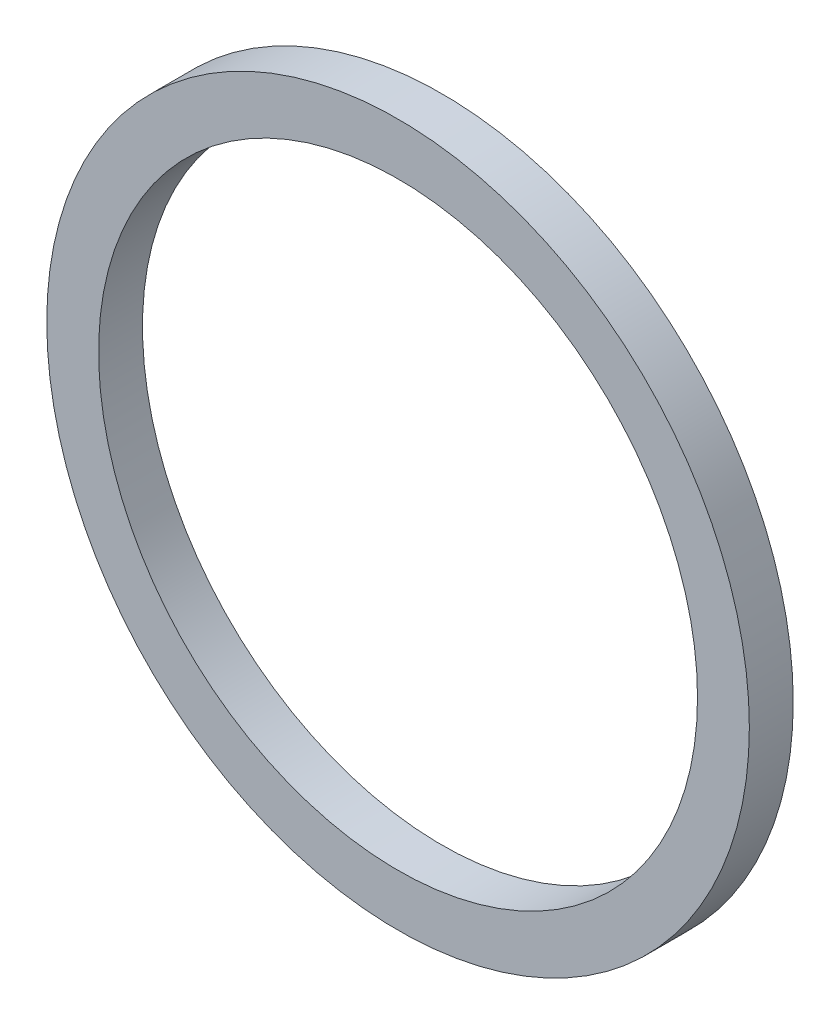
from build123d import *

# Parameters (mm, degrees)
BOSS_EXTRUDE1_DEPTH      = 19.05
BOSS_EXTRUDE1_DEPTH_BACK = 19.05
SKETCH1_R                = 305
SKETCH1_R_2              = 260


with BuildPart() as part:
    # Sketch1 → Boss-Extrude1 (new, two sides: drawn at the far end of the back side and taken through both)
    with BuildSketch(Plane.XY.offset(-BOSS_EXTRUDE1_DEPTH_BACK)):
        Circle(SKETCH1_R)
        Circle(SKETCH1_R_2, mode=Mode.SUBTRACT)
    extrude(amount=BOSS_EXTRUDE1_DEPTH + BOSS_EXTRUDE1_DEPTH_BACK)


solid = part.part
